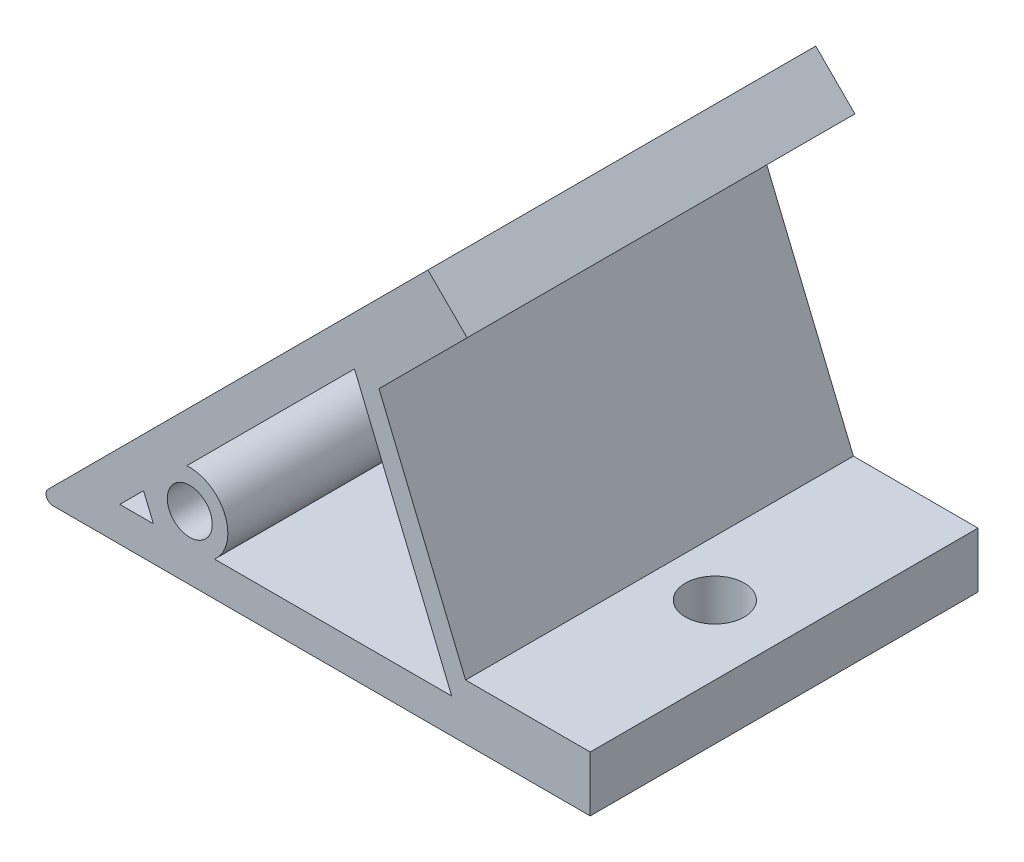
from build123d import *

# Parameters (mm, degrees)
SKETCH_1_R          = 3.25
EXTRUDE_1_DEPTH     = 28
SKETCH_3_R          = 4.25
CUT_EXTRUDE_1_DEPTH = 17


with BuildPart() as part:
    # 草图1 → 凸台-拉伸1 (new, symmetric)
    with BuildSketch(Plane.XY):
        with BuildLine():
            Line((-77.585786438, 0), (0, 0))
            Line((0, 0), (0, 8))
            Line((0, 8), (-17.995464086, 8))
            Line((-17.995464086, 8), (-30.499317942, 38.186973559))
            Line((-30.499317942, 38.186973559), (-17.774603256, 50.911688245))
            Line((-17.774603256, 50.911688245), (-23.431457505, 56.568542495))
            Line((-23.431457505, 56.568542495), (-78.292893219, 1.707106781))
            ThreePointArc((-78.292893219, 1.707106781), (-78.50966597, 0.617316568), (-77.585786438, 0))
        make_face()
        with Locations((-57.82689122, 9.184402377)):
            Circle(SKETCH_1_R, mode=Mode.SUBTRACT)
        Polygon((-67.928932188, 5), (-63.07447047, 5), (-64.496309389, 8.4326228), align=None, mode=Mode.SUBTRACT)
        with BuildLine():
            Line((-54.257468753, 5), (-20, 5))
            Line((-20, 5), (-34.038059223, 38.890872965))
            Line((-34.038059223, 38.890872965), (-58.261747684, 14.667184504))
            ThreePointArc((-58.261747684, 14.667184504), (-52.745553791, 11.289161255), (-54.257468753, 5))
        make_face(mode=Mode.SUBTRACT)
    extrude(amount=EXTRUDE_1_DEPTH, both=True)

    # 草图3 → 切除-拉伸1 (cut)
    with BuildSketch(Plane(origin=(0, 8, 0), x_dir=(1, 0, 0), z_dir=(0, 1, 0))):
        with Locations(Location((-10, 0, 0), (0, 0, 180))):
            Circle(SKETCH_3_R)
    cut_extrude_1 = extrude(amount=-CUT_EXTRUDE_1_DEPTH, mode=Mode.SUBTRACT)

    # 镜向1: 切除-拉伸1 across plane
    add(cut_extrude_1.mirror(Plane(origin=(-11.715728753, 28.284271247, 0), x_dir=(0, 0, 1), z_dir=(-0.3826834323650881, 0.9238795325112875, 0))), mode=Mode.SUBTRACT)


solid = part.part
